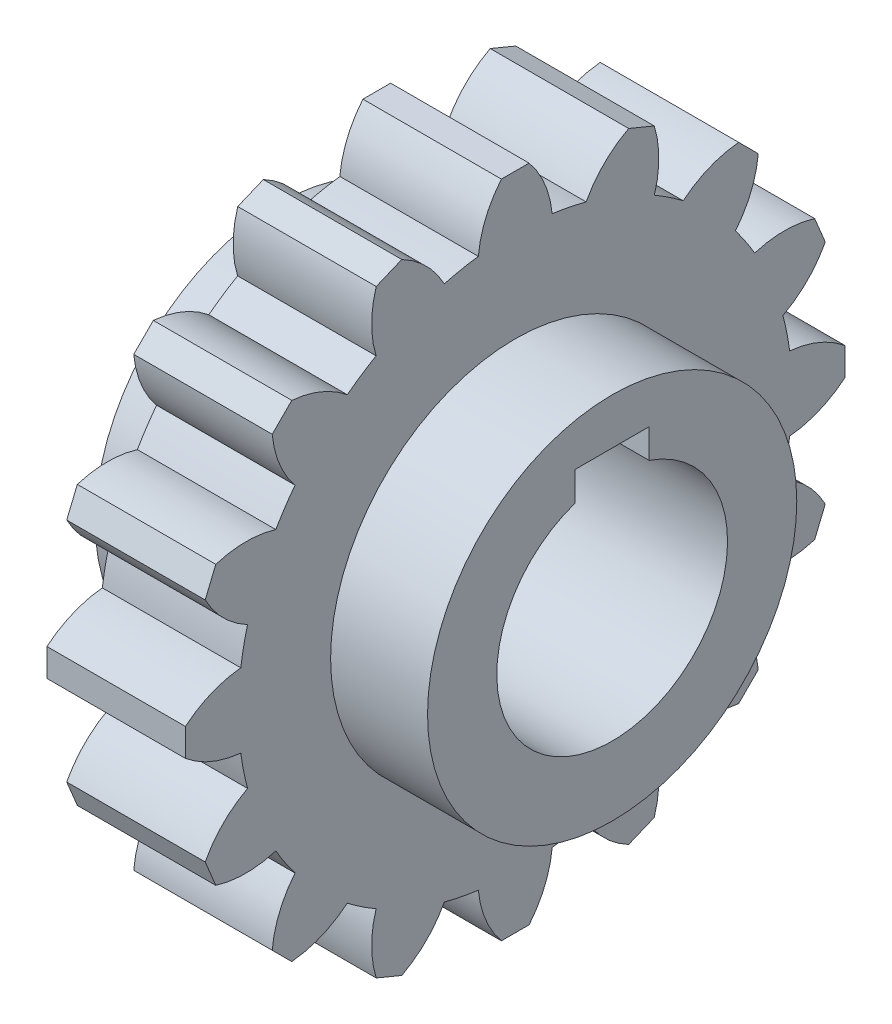
from build123d import *

# Parameters (mm, degrees)
SKETCH1_R               = 30
BOSS_EXTRUDE1_DEPTH     = 7.5
BOSS_EXTRUDE2_DEPTH     = 15
CIRPATTERN1_COUNT       = 16
SKETCH3_R               = 20
BOSS_EXTRUDE3_DEPTH     = 18
CUT_EXTRUDE1_DEPTH      = 63.04491357
CUT_EXTRUDE1_DEPTH_BACK = 63.04491357


with BuildPart() as part:
    # Sketch1 → Boss-Extrude1 (new, symmetric)
    with BuildSketch(Plane(origin=(0, 0, 0), x_dir=(0, 0, -1), z_dir=(1, 0, 0))):
        Circle(SKETCH1_R)
    extrude(amount=BOSS_EXTRUDE1_DEPTH, both=True)

    # Sketch2 → Boss-Extrude2 (add)
    with BuildSketch(Plane(origin=(7.5, 0, 0), x_dir=(0, 0, -1), z_dir=(1, 0, 0))):
        with BuildLine():
            Line((-1.5, 35.732137495), (1.5, 35.732137495))
            ThreePointArc((1.5, 35.732137495), (3.203300204, 32.92101258), (4, 29.732137495))
            ThreePointArc((4, 29.732137495), (0, 30), (-4, 29.732137495))
            ThreePointArc((-4, 29.732137495), (-3.203300204, 32.92101258), (-1.5, 35.732137495))
        make_face()
    boss_extrude2 = extrude(amount=-BOSS_EXTRUDE2_DEPTH)

    # CirPattern1: Boss-Extrude2 ×16 about axis
    cirpattern1_axis = Axis((0, 0, 0), (1, 0, 0))
    for i in range(1, CIRPATTERN1_COUNT):
        add(boss_extrude2.rotate(cirpattern1_axis, i * 360 / CIRPATTERN1_COUNT))

    # Sketch3 → Boss-Extrude3 (add, symmetric)
    with BuildSketch(Plane(origin=(0, 0, 0), x_dir=(0, 0, -1), z_dir=(1, 0, 0))):
        Circle(SKETCH3_R)
    extrude(amount=BOSS_EXTRUDE3_DEPTH, both=True)

    # Sketch4 → Cut-Extrude1 (cut, two sides: drawn at the far end of the back side and taken through both)
    with BuildSketch(Plane.ZY.offset(18).offset(-CUT_EXTRUDE1_DEPTH_BACK)):
        with BuildLine():
            Line((-4, 15), (4, 15))
            Line((4, 15), (4, 11.842719282))
            ThreePointArc((4, 11.842719282), (0, -12.5), (-4, 11.842719282))
            Line((-4, 11.842719282), (-4, 15))
        make_face()
    extrude(amount=CUT_EXTRUDE1_DEPTH + CUT_EXTRUDE1_DEPTH_BACK, mode=Mode.SUBTRACT)


solid = part.part
